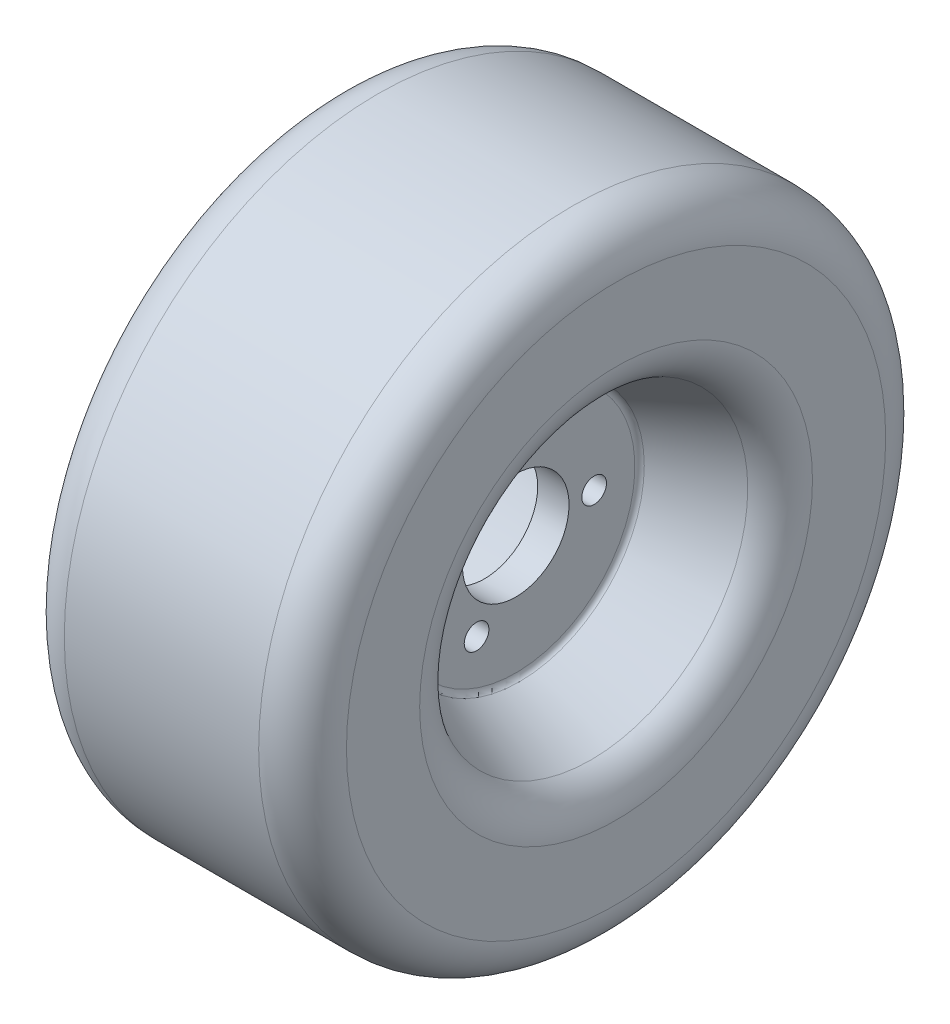
from build123d import *

# Parameters (mm, degrees)
CUT_EXTRUDE2_DEPTH      = 189.478440412
CUT_EXTRUDE2_DEPTH_BACK = 189.478440412
SKETCH3_R               = 21.59
CUT_EXTRUDE3_DEPTH      = 189.478440412
CUT_EXTRUDE3_DEPTH_BACK = 189.478440412
SKETCH4_R               = 5
FILLET1_R               = 2.54


with BuildPart() as part:
    # Sketch1 → Revolve2 (revolve)
    with BuildSketch(Plane.XY, mode=Mode.PRIVATE) as revolve2_sk:
        with BuildLine():
            Line((-39.37, 127), (39.37, 127))
            ThreePointArc((39.37, 127), (51.942358569, 121.792358569), (57.15, 109.22))
            Line((57.15, 109.22), (57.15, 79.564370514))
            ThreePointArc((57.15, 79.564370514), (54.396842649, 70.060560751), (46.99, 63.5))
            Line((46.99, 63.5), (16.51, 49.891733232))
            Line((16.51, 49.891733232), (16.51, 0))
            Line((16.51, 0), (3.796742982, 0))
            Line((3.796742982, 0), (3.796742982, 49.891733232))
            Line((3.796742982, 49.891733232), (-46.99, 63.5))
            ThreePointArc((-46.99, 63.5), (-54.396842649, 70.060560751), (-57.15, 79.564370514))
            Line((-57.15, 79.564370514), (-57.15, 109.22))
            ThreePointArc((-57.15, 109.22), (-51.942358569, 121.792358569), (-39.37, 127))
        make_face()
    revolve(revolve2_sk.sketch.rotate(Axis((3.796742982, 0, 0), (1, 0, 0)), 90), axis=Axis((3.796742982, 0, 0), (1, 0, 0)))

    # Sketch3 → Cut-Extrude2 (cut, two sides: drawn at the far end of the back side and taken through both)
    with BuildSketch(Plane(origin=(0, 0, 0), x_dir=(0, 0, -1), z_dir=(1, 0, 0)).offset(-CUT_EXTRUDE2_DEPTH_BACK)):
        Circle(SKETCH3_R)
    extrude(amount=CUT_EXTRUDE2_DEPTH + CUT_EXTRUDE2_DEPTH_BACK, mode=Mode.SUBTRACT)

    # Sketch4 → Cut-Extrude3 (cut, two sides: drawn at the far end of the back side and taken through both)
    with BuildSketch(Plane(origin=(0, 0, 0), x_dir=(0, 0, -1), z_dir=(1, 0, 0)).offset(-CUT_EXTRUDE3_DEPTH_BACK)):
        with Locations((31.75, 0)):
            Circle(SKETCH4_R)
        with Locations((-15.875, -27.49630657)):
            Circle(SKETCH4_R)
        with Locations((-15.875, 27.49630657)):
            Circle(SKETCH4_R)
    extrude(amount=CUT_EXTRUDE3_DEPTH + CUT_EXTRUDE3_DEPTH_BACK, mode=Mode.SUBTRACT)

    # Fillet1
    fillet1_edges = [part.edges().sort_by_distance(p)[0] for p in [
        (16.51, 0, -49.891733232),
        (3.796742982, 0, -49.891733232),
    ]]
    fillet(fillet1_edges, radius=FILLET1_R)


solid = part.part
